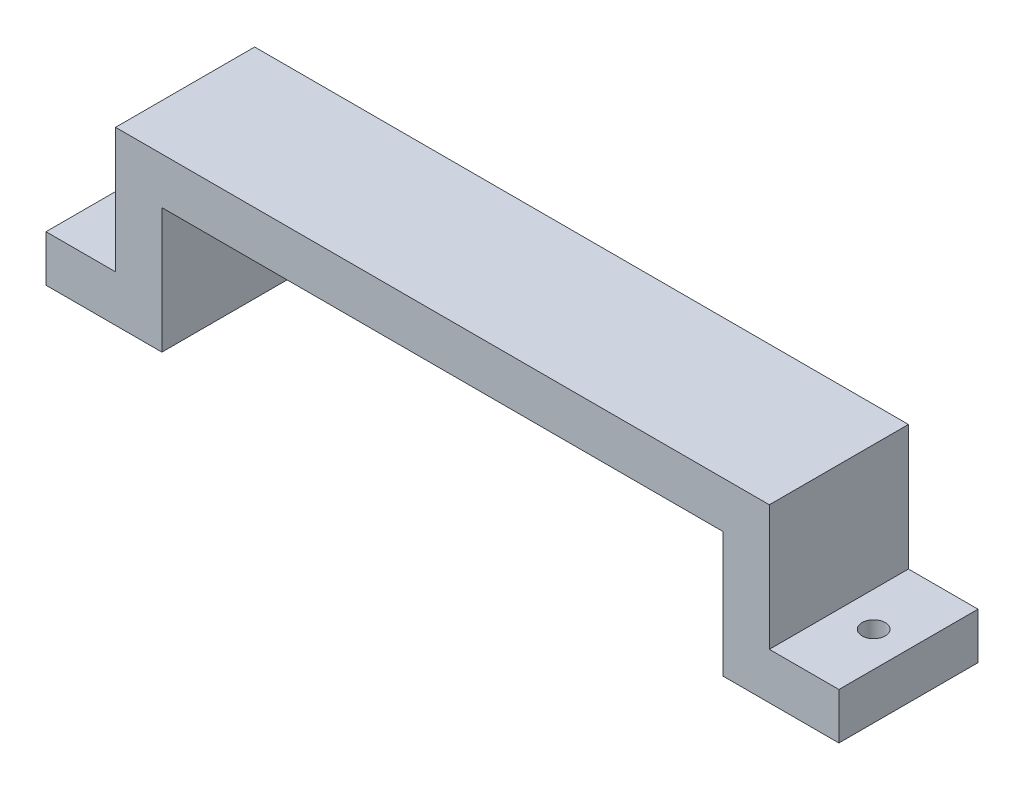
from build123d import *

# Parameters (mm, degrees)
BOSS_EXTRUDE1_DEPTH      = 15
BOSS_EXTRUDE1_DEPTH_BACK = 15
SKETCH3_R                = 2.5
CUT_EXTRUDE1_DEPTH       = 15


with BuildPart() as part:
    # Sketch2 → Boss-Extrude1 (new, two sides: drawn at the far end of the back side and taken through both)
    with BuildSketch(Plane.XY.offset(-BOSS_EXTRUDE1_DEPTH_BACK)):
        Polygon((-60.5, 0), (-60.5, 27), (0, 27), (0, 37), (-70.5, 37), (-70.5, 10), (-85.5, 10), (-85.5, 0), align=None)
    extrude(amount=BOSS_EXTRUDE1_DEPTH + BOSS_EXTRUDE1_DEPTH_BACK)

    # Mirror1: part across plane


with BuildPart() as part_1:
    add(part.part)
    add(part.part.mirror(Plane(origin=(0, 0, 0), x_dir=(0, 0, 1), z_dir=(1, 0, 0))))

    # Sketch3 → Cut-Extrude1 (cut)
    with BuildSketch(Plane(origin=(0, 10, 0), x_dir=(1, 0, 0), z_dir=(0, 1, 0))):
        with Locations((-78, 0)):
            Circle(SKETCH3_R)
        with Locations((78, 0)):
            Circle(SKETCH3_R)
    extrude(amount=-CUT_EXTRUDE1_DEPTH, mode=Mode.SUBTRACT)


solid = part_1.part
